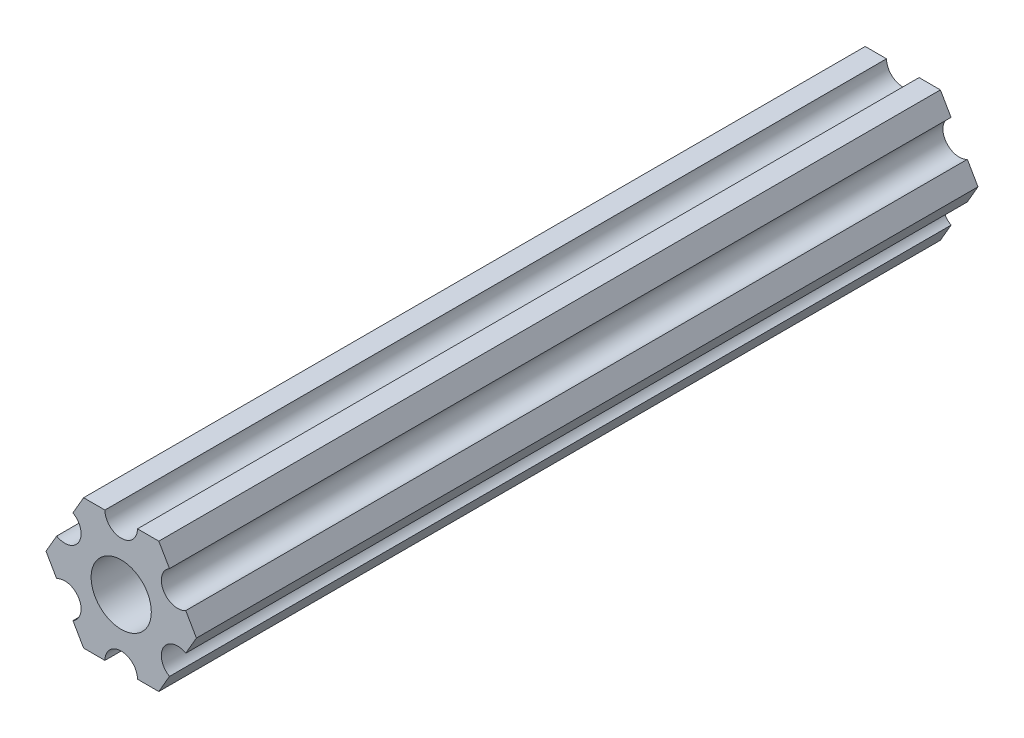
from build123d import *

# Parameters (mm, degrees)
SKETCH1_R           = 2.9337
BOSS_EXTRUDE1_DEPTH = 76.2


with BuildPart() as part:
    # Sketch1 → Boss-Extrude1 (new body)
    with BuildSketch(Plane(origin=(0, 0, 0), x_dir=(-1, 0, 0), z_dir=(0, 0, -1))):
        with BuildLine():
            Line((-4.70551159, -4.549815043), (-3.666174521, -6.349999904))
            Line((-3.666174521, -6.349999904), (-1.587500385, -6.349999904))
            ThreePointArc((-1.587500385, -6.349999904), (-3.85e-07, -4.762499904), (1.587499615, -6.349999904))
            Line((1.587499615, -6.349999904), (3.666173825, -6.349999904))
            Line((3.666173825, -6.349999904), (4.705510942, -4.54981524))
            ThreePointArc((4.705510942, -4.54981524), (4.124445629, -2.381249907), (6.293010962, -1.800184594))
            Line((6.293010962, -1.800184594), (7.332348079, 7e-08))
            Line((7.332348079, 7e-08), (6.293011217, 1.800184685))
            ThreePointArc((6.293011217, 1.800184685), (4.124445939, 2.381250203), (4.705511457, 4.549815481))
            Line((4.705511457, 4.549815481), (3.666174521, 6.350000222))
            Line((3.666174521, 6.350000222), (1.587500385, 6.350000222))
            ThreePointArc((1.587500385, 6.350000222), (3.85e-07, 4.762500222), (-1.587499615, 6.350000222))
            Line((-1.587499615, 6.350000222), (-3.666173825, 6.350000222))
            Line((-3.666173825, 6.350000222), (-4.705511038, 4.549815614))
            ThreePointArc((-4.705511038, 4.549815614), (-4.124445841, 2.38125025), (-6.293011205, 1.800185053))
            Line((-6.293011205, 1.800185053), (-7.332348419, 4.44e-07))
            Line((-7.332348419, 4.44e-07), (-6.293011423, -1.80018429))
            ThreePointArc((-6.293011423, -1.80018429), (-4.12444613, -2.38124975), (-4.70551159, -4.549815043))
        make_face()
        with Locations(Location((0, 0, 0), (0, 0, 180))):
            Circle(SKETCH1_R, mode=Mode.SUBTRACT)
    extrude(amount=BOSS_EXTRUDE1_DEPTH)


solid = part.part
